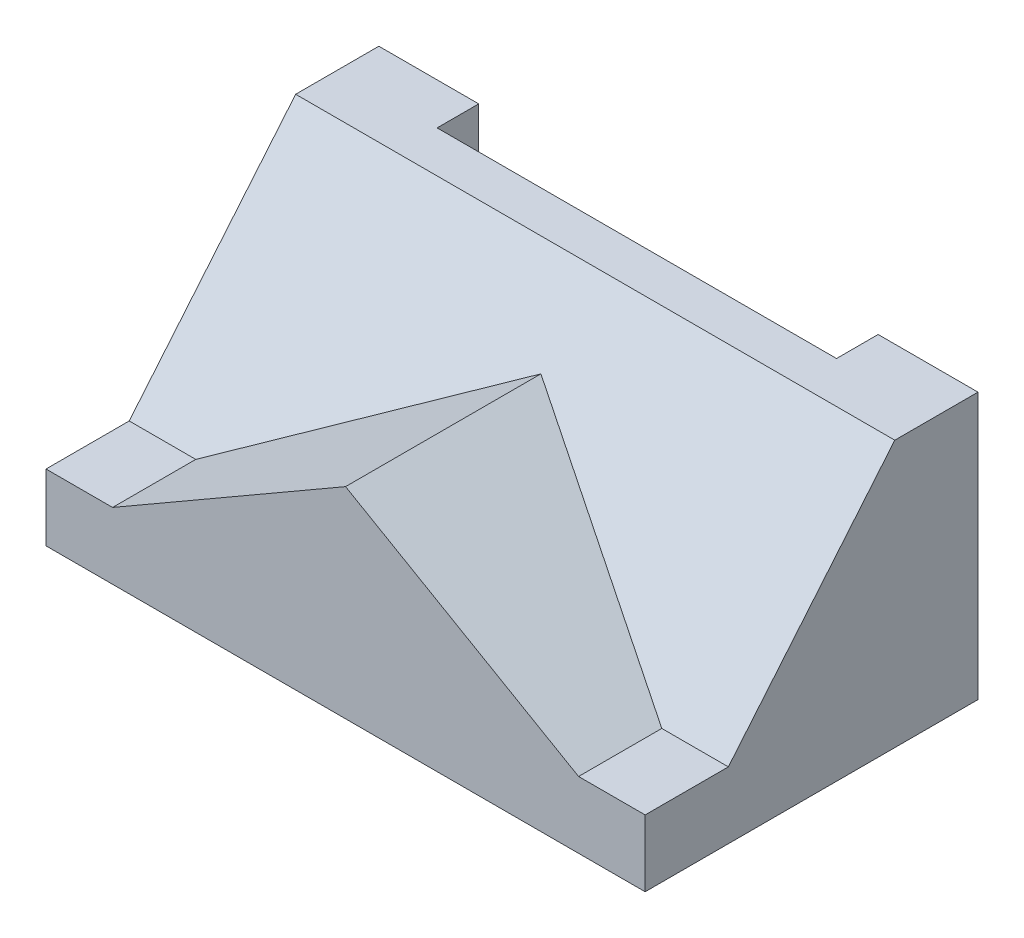
from build123d import *

# Parameters (mm, degrees)
EXTRUDE_1_DEPTH     = 36
EXTRUDE_2_REACH     = 64.61
SKETCH_3_W          = 48
SKETCH_3_H          = 5
CUT_EXTRUDE_3_DEPTH = 63.60990337


with BuildPart() as part:
    # 草圖1 → 伸長1 (new, symmetric)
    with BuildSketch(Plane(origin=(0, 0, 0), x_dir=(0, 0, -1), z_dir=(1, 0, 0))):
        Polygon((0, 0), (40, 0), (40, 32), (30, 32), (10, 8), (0, 8), align=None)
    extrude(amount=EXTRUDE_1_DEPTH, both=True)

    # 伸長2: up to this plane
    extrude_2_end = Plane(origin=(36, 8, -10), z_dir=(0, -0.6401843996644799, -0.7682212795973757))
    # 草圖2 → 伸長2 (add, up to the surface)
    with BuildSketch(Plane.XY, mode=Mode.PRIVATE) as extrude_2_sk1:
        Polygon((28, 8), (-28, 8), (0, 24.165807537), align=None)
    extrude_2_tool1 = split(extrude(extrude_2_sk1.sketch, amount=-EXTRUDE_2_REACH, mode=Mode.PRIVATE), bisect_by=extrude_2_end, keep=Keep.BOTH, mode=Mode.PRIVATE)
    add(extrude_2_tool1.solids().sort_by_distance((0, 13.388603, 0))[0])

    # 草圖3 → 伸長3 (cut, through all)
    with BuildSketch(Plane(origin=(0, 32, 0), x_dir=(1, 0, 0), z_dir=(0, 1, 0))):
        with Locations((0, 37.5)):
            Rectangle(SKETCH_3_W, SKETCH_3_H)
    extrude(amount=-CUT_EXTRUDE_3_DEPTH, mode=Mode.SUBTRACT)


solid = part.part
